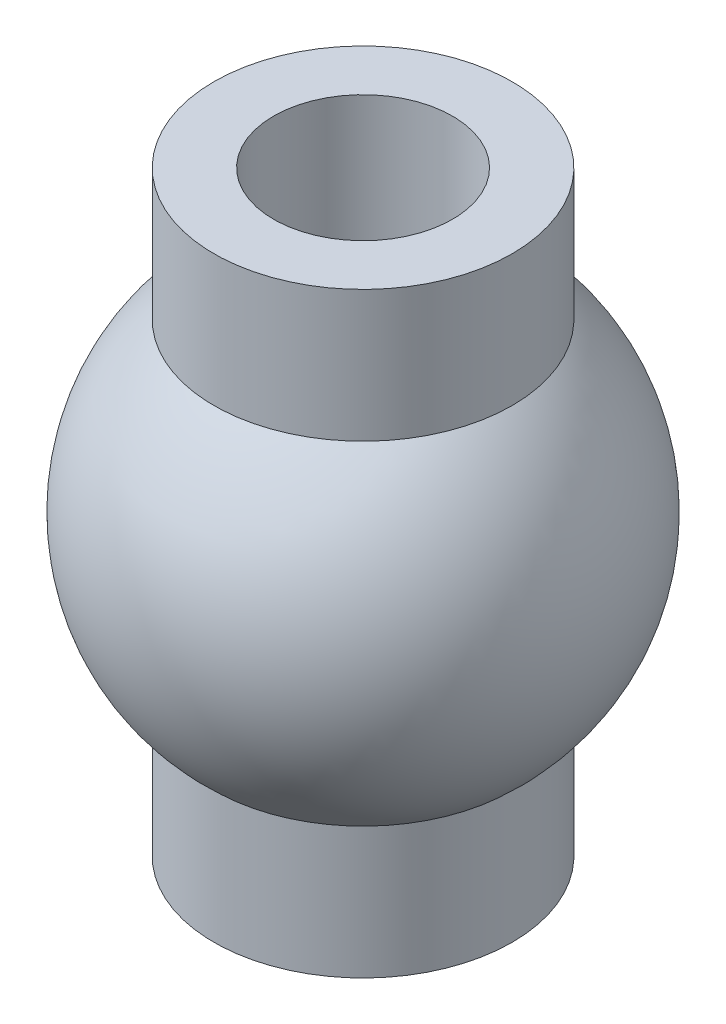
from build123d import *

# Parameters (mm, degrees)
SKETCH_2_R          = 3
CUT_EXTRUDE_1_DEPTH = 23.638462845


with BuildPart() as part:
    # 草图1 → 旋转1 (revolve)
    with BuildSketch(Plane.XY, mode=Mode.PRIVATE) as revolve_1_sk:
        with BuildLine():
            Line((0, 20), (5, 20))
            Line((5, 20), (5, 15.590169944))
            ThreePointArc((5, 15.590169944), (7.5, 10), (5, 4.409830056))
            Line((5, 4.409830056), (5, 0))
            Line((5, 0), (0, 0))
            Line((0, 0), (0, 20))
        make_face()
    revolve(revolve_1_sk.sketch.rotate(Axis((0, 20, 0), (0, -1, 0)), 180), axis=Axis((0, 20, 0), (0, -1, 0)))

    # 草图2 → 切除-拉伸1 (cut, through all)
    with BuildSketch(Plane(origin=(0, 20, 0), x_dir=(1, 0, 0), z_dir=(0, 1, 0))):
        with Locations(Location((0, 0, 0), (0, 0, 180))):
            Circle(SKETCH_2_R)
    extrude(amount=-CUT_EXTRUDE_1_DEPTH, mode=Mode.SUBTRACT)


solid = part.part
